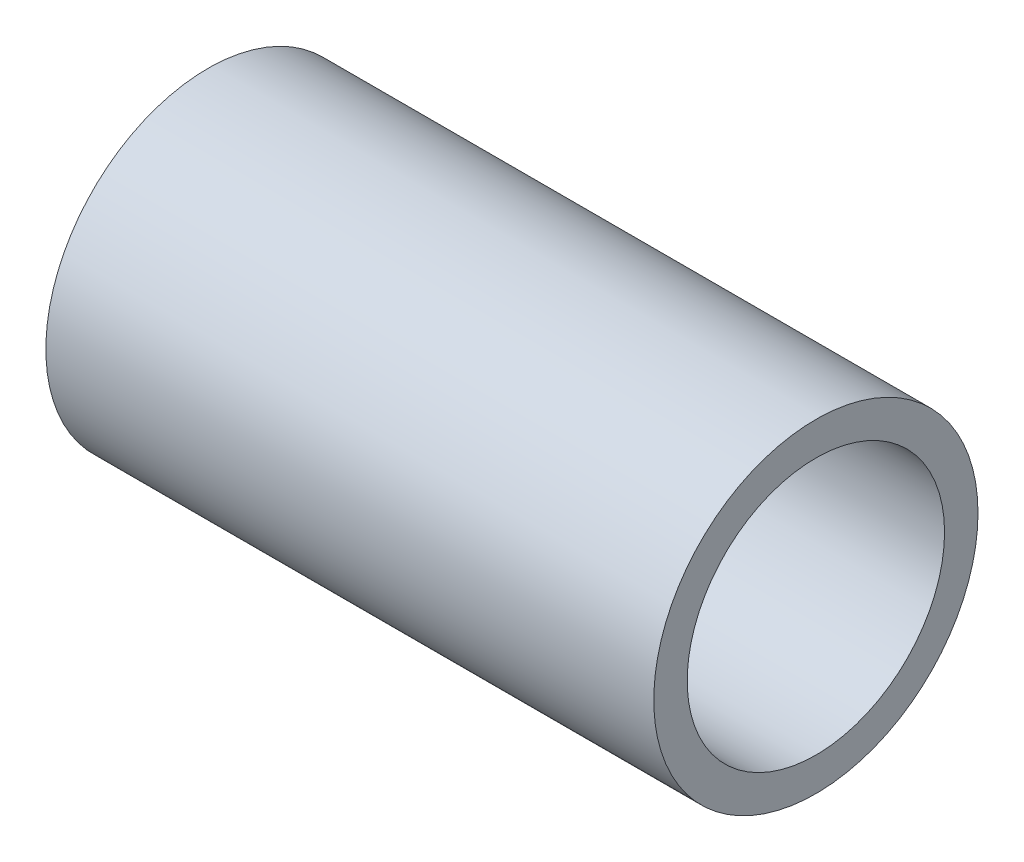
from build123d import *

# Parameters (mm, degrees)
SKETCH1_R           = 2
SKETCH1_R_2         = 1.5875
BOSS_EXTRUDE1_DEPTH = 7.5


with BuildPart() as part:
    # Sketch1 → Boss-Extrude1 (new body)
    with BuildSketch(Plane(origin=(0, 0, 0), x_dir=(0, 0, -1), z_dir=(1, 0, 0))):
        Circle(SKETCH1_R)
        Circle(SKETCH1_R_2, mode=Mode.SUBTRACT)
    extrude(amount=BOSS_EXTRUDE1_DEPTH)


solid = part.part
